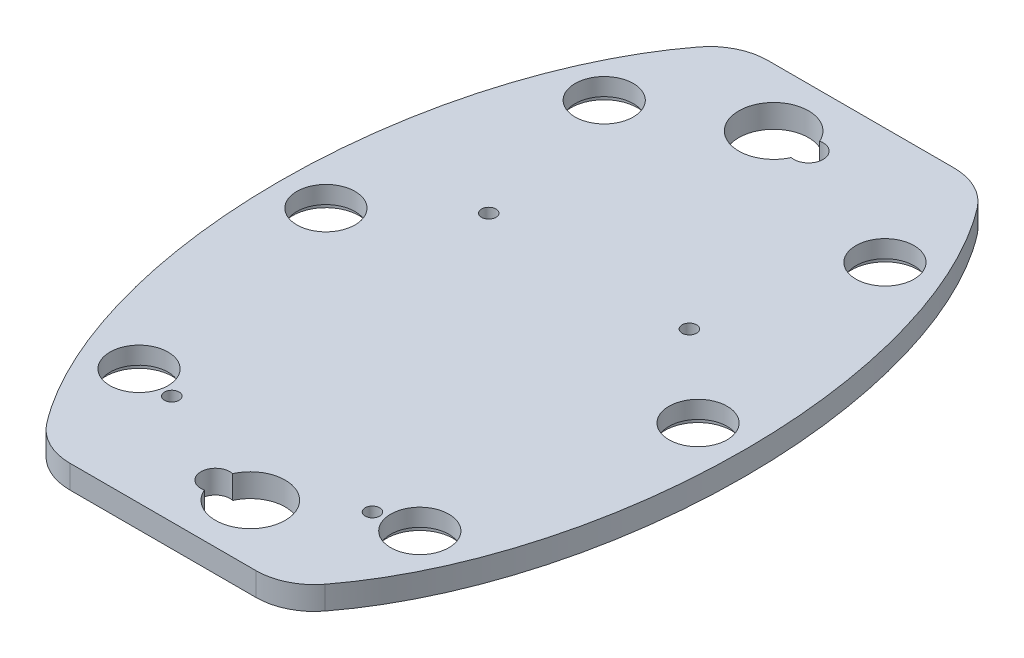
from build123d import *

# Parameters (mm, degrees)
SKETCH1_R           = 5
BOSS_EXTRUDE1_DEPTH = 4
SKETCH3_R           = 5.75
CUT_EXTRUDE2_DEPTH  = 1
CUT_EXTRUDE3_REACH  = 74.222
SKETCH4_R           = 1.25


with BuildPart() as part:
    # Sketch1 → Boss-Extrude1 (new body)
    with BuildSketch(Plane(origin=(0, 0, 0), x_dir=(1, 0, 0), z_dir=(0, 1, 0))):
        with BuildLine():
            Line((-15.999553812, 60), (15.999553812, 60))
            ThreePointArc((15.999553812, 60), (20.429760931, 58.965113769), (23.94301598, 56.074652977))
            add(Edge.make_bspline(
                [(23.94301598, -56.074652977), (66.825332337, 0), (23.94301598, 56.074652977)],
                knots=[3.783314198, 3.783314198, 3.783314198, 5.641463762, 5.641463762, 5.641463762], degree=2, weights=[1, 0.598575399, 1]))
            ThreePointArc((23.94301598, -56.074652977), (20.429760931, -58.965113769), (15.999553812, -60))
            Line((15.999553812, -60), (-15.999553812, -60))
            ThreePointArc((-15.999553812, -60), (-20.429760931, -58.965113769), (-23.94301598, -56.074652977))
            add(Edge.make_bspline(
                [(-23.94301598, 56.074652977), (-66.825332337, 0), (-23.94301598, -56.074652977)],
                knots=[0.641721545, 0.641721545, 0.641721545, 2.499871109, 2.499871109, 2.499871109], degree=2, weights=[1, 0.598575399, 1]))
            ThreePointArc((-23.94301598, 56.074652977), (-20.429760931, 58.965113769), (-15.999553812, 60))
        make_face()
        with Locations(Location((-32, 0, 0), (0, 0, 270))):
            Circle(SKETCH1_R, mode=Mode.SUBTRACT)
        with Locations(Location((-24.141452548, 40, 0), (0, 0, 270))):
            Circle(SKETCH1_R, mode=Mode.SUBTRACT)
        with Locations(Location((-24.141452548, -40, 0), (0, 0, 270))):
            Circle(SKETCH1_R, mode=Mode.SUBTRACT)
        with Locations(Location((24.141452548, -40, 0), (0, 0, 90))):
            Circle(SKETCH1_R, mode=Mode.SUBTRACT)
        with Locations(Location((32, 0, 0), (0, 0, 90))):
            Circle(SKETCH1_R, mode=Mode.SUBTRACT)
        with Locations(Location((24.141452548, 40, 0), (0, 0, 90))):
            Circle(SKETCH1_R, mode=Mode.SUBTRACT)
        with BuildLine():
            ThreePointArc((-0.479166667, -52.445144707), (11, -50), (-0.479166667, -47.554855293))
            ThreePointArc((-0.479166667, -47.554855293), (-3.5, -50), (-0.479166667, -52.445144707))
        make_face(mode=Mode.SUBTRACT)
        with BuildLine():
            ThreePointArc((0.479166667, 52.445144707), (-11, 50), (0.479166667, 47.554855293))
            ThreePointArc((0.479166667, 47.554855293), (3.5, 50), (0.479166667, 52.445144707))
        make_face(mode=Mode.SUBTRACT)
    extrude(amount=BOSS_EXTRUDE1_DEPTH)

    # Sketch3 → Cut-Extrude2 (cut)
    with BuildSketch(Plane.XZ):
        with Locations(Location((-24.141452548, -40, 0), (0, 0, 270))):
            Circle(SKETCH3_R)
        with Locations(Location((24.141452548, -40, 0), (0, 0, 270))):
            Circle(SKETCH3_R)
        with Locations(Location((32, 0, 0), (0, 0, 270))):
            Circle(SKETCH3_R)
        with Locations(Location((24.141452548, 40, 0), (0, 0, 270))):
            Circle(SKETCH3_R)
        with Locations(Location((-24.141452548, 40, 0), (0, 0, 270))):
            Circle(SKETCH3_R)
        with Locations(Location((-32, 0, 0), (0, 0, 270))):
            Circle(SKETCH3_R)
    extrude(amount=-CUT_EXTRUDE2_DEPTH, mode=Mode.SUBTRACT)

    # Sketch4 → Cut-Extrude3 (cut, up to next)
    with BuildSketch(Plane(origin=(0, 4, 0), x_dir=(1, 0, 0), z_dir=(0, 1, 0)), mode=Mode.PRIVATE) as cut_extrude3_sk1:
        with Locations(Location((17.25, -41.25, 0), (0, 0, 270))):
            Circle(SKETCH4_R)
    cut_extrude3_tool1 = extrude(cut_extrude3_sk1.sketch, amount=-CUT_EXTRUDE3_REACH, mode=Mode.PRIVATE) & part.part
    # Sketch4 → Cut-Extrude3 (cut, up to next)
    with BuildSketch(Plane(origin=(0, 4, 0), x_dir=(1, 0, 0), z_dir=(0, 1, 0)), mode=Mode.PRIVATE) as cut_extrude3_sk2:
        with Locations(Location((17.25, 13.25, 0), (0, 0, 270))):
            Circle(SKETCH4_R)
    cut_extrude3_tool2 = extrude(cut_extrude3_sk2.sketch, amount=-CUT_EXTRUDE3_REACH, mode=Mode.PRIVATE) & part.part
    # Sketch4 → Cut-Extrude3 (cut, up to next)
    with BuildSketch(Plane(origin=(0, 4, 0), x_dir=(1, 0, 0), z_dir=(0, 1, 0)), mode=Mode.PRIVATE) as cut_extrude3_sk3:
        with Locations(Location((-17.25, 13.25, 0), (0, 0, 270))):
            Circle(SKETCH4_R)
    cut_extrude3_tool3 = extrude(cut_extrude3_sk3.sketch, amount=-CUT_EXTRUDE3_REACH, mode=Mode.PRIVATE) & part.part
    # Sketch4 → Cut-Extrude3 (cut, up to next)
    with BuildSketch(Plane(origin=(0, 4, 0), x_dir=(1, 0, 0), z_dir=(0, 1, 0)), mode=Mode.PRIVATE) as cut_extrude3_sk4:
        with Locations(Location((-17.25, -41.25, 0), (0, 0, 270))):
            Circle(SKETCH4_R)
    cut_extrude3_tool4 = extrude(cut_extrude3_sk4.sketch, amount=-CUT_EXTRUDE3_REACH, mode=Mode.PRIVATE) & part.part
    add(cut_extrude3_tool1.solids().sort_by_distance((17.25, 4, 41.25))[0], mode=Mode.SUBTRACT)
    add(cut_extrude3_tool2.solids().sort_by_distance((17.25, 4, -13.25))[0], mode=Mode.SUBTRACT)
    add(cut_extrude3_tool3.solids().sort_by_distance((-17.25, 4, -13.25))[0], mode=Mode.SUBTRACT)
    add(cut_extrude3_tool4.solids().sort_by_distance((-17.25, 4, 41.25))[0], mode=Mode.SUBTRACT)


solid = part.part
